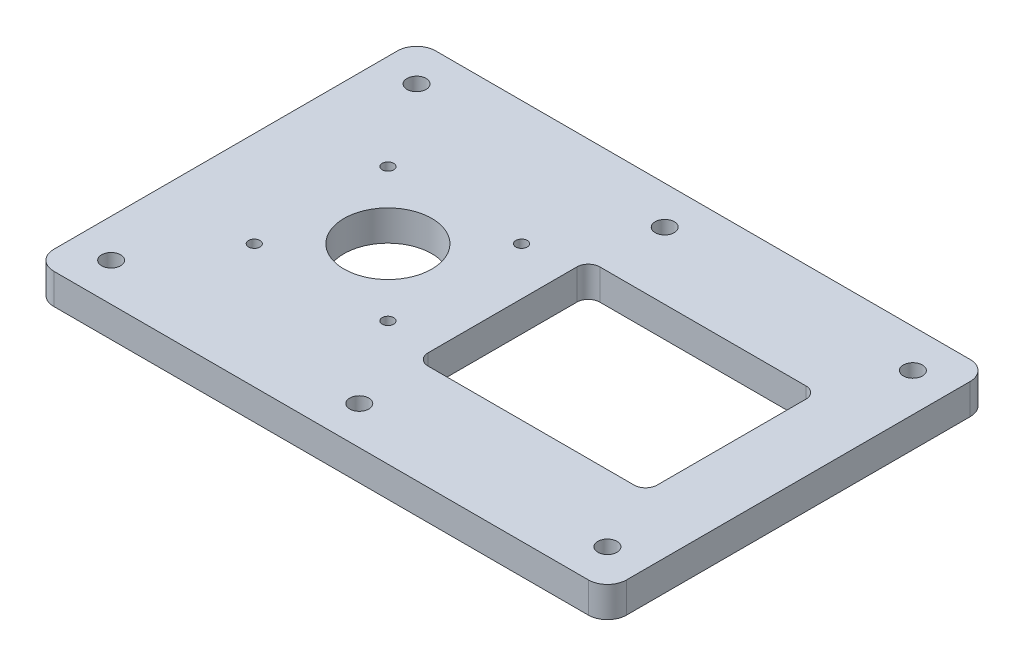
from build123d import *

# Parameters (mm, degrees)
SKETCH1_W           = 150
SKETCH1_H           = 100
SKETCH1_R           = 2.5
SKETCH1_R_2         = 11.5
SKETCH1_R_3         = 1.5
SKETCH1_W_2         = 60
SKETCH1_H_2         = 45
BOSS_EXTRUDE1_DEPTH = 8
FILLET2_R           = 5
FILLET4_R           = 3


with BuildPart() as part:
    # Sketch1 → Boss-Extrude1 (new body)
    with BuildSketch(Plane(origin=(0, 0, 0), x_dir=(1, 0, 0), z_dir=(0, 1, 0))):
        Rectangle(SKETCH1_W, SKETCH1_H)
        with Locations(Location((-65, 40, 0), (0, 0, 270))):
            Circle(SKETCH1_R, mode=Mode.SUBTRACT)
        with Locations(Location((0, 40, 0), (0, 0, 270))):
            Circle(SKETCH1_R, mode=Mode.SUBTRACT)
        with Locations(Location((65, 40, 0), (0, 0, 270))):
            Circle(SKETCH1_R, mode=Mode.SUBTRACT)
        with Locations(Location((0, -40, 0), (0, 0, 270))):
            Circle(SKETCH1_R, mode=Mode.SUBTRACT)
        with Locations(Location((65, -40, 0), (0, 0, 270))):
            Circle(SKETCH1_R, mode=Mode.SUBTRACT)
        with Locations(Location((-65, -40, 0), (0, 0, 270))):
            Circle(SKETCH1_R, mode=Mode.SUBTRACT)
        with Locations(Location((-32.5, 0, 0), (0, 0, 270))):
            Circle(SKETCH1_R_2, mode=Mode.SUBTRACT)
        with Locations(Location((-50, 17.5, 0), (0, 0, 270))):
            Circle(SKETCH1_R_3, mode=Mode.SUBTRACT)
        with Locations(Location((-15, 17.5, 0), (0, 0, 270))):
            Circle(SKETCH1_R_3, mode=Mode.SUBTRACT)
        with Locations(Location((-15, -17.5, 0), (0, 0, 270))):
            Circle(SKETCH1_R_3, mode=Mode.SUBTRACT)
        with Locations(Location((-50, -17.5, 0), (0, 0, 270))):
            Circle(SKETCH1_R_3, mode=Mode.SUBTRACT)
        with Locations((27.5, 0)):
            Rectangle(SKETCH1_W_2, SKETCH1_H_2, mode=Mode.SUBTRACT)
    extrude(amount=BOSS_EXTRUDE1_DEPTH)

    # Fillet2
    fillet2_edges = [part.edges().sort_by_distance(p)[0] for p in [
        (-75, 4, 50),
        (-75, 4, -50),
        (75, 4, -50),
        (75, 4, 50),
    ]]
    fillet(fillet2_edges, radius=FILLET2_R)

    # Fillet4
    fillet4_edges = [part.edges().sort_by_distance(p)[0] for p in [
        (57.5, 4, 22.5),
        (57.5, 4, -22.5),
        (-2.5, 4, -22.5),
        (-2.5, 4, 22.5),
    ]]
    fillet(fillet4_edges, radius=FILLET4_R)


solid = part.part
